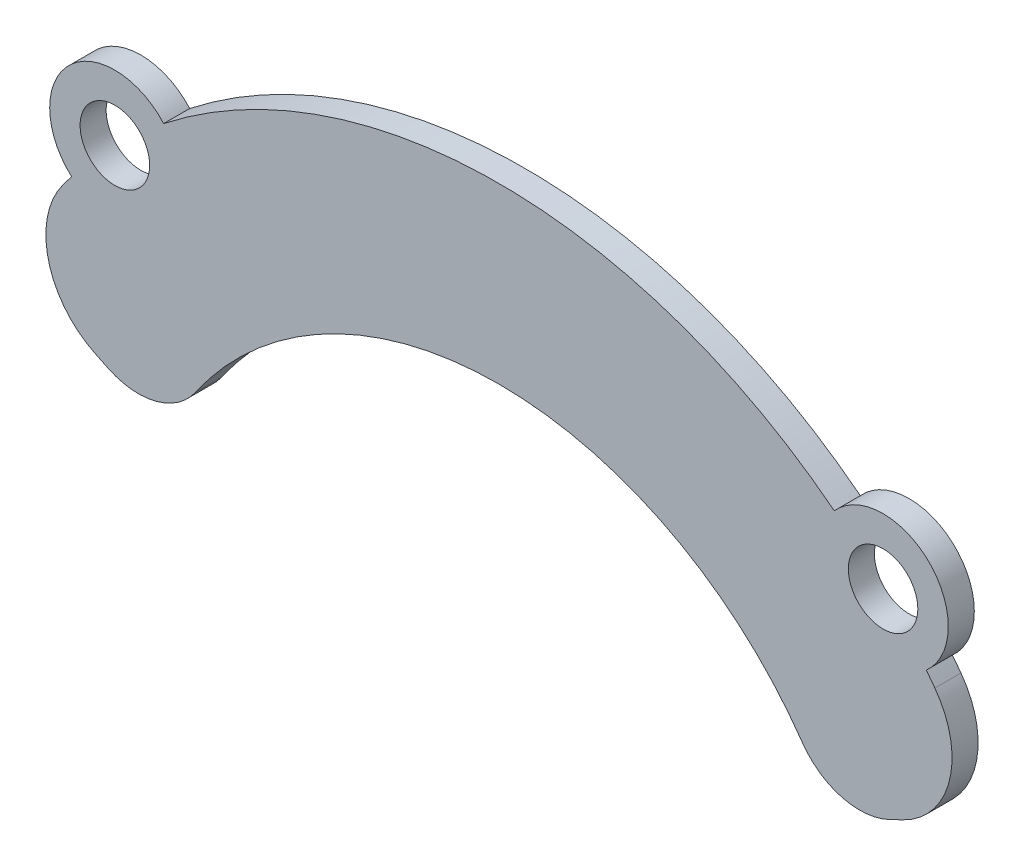
from build123d import *

# Parameters (mm, degrees)
BOSS_EXTRUDE1_DEPTH = 3
SKETCH2_R           = 4
CUT_EXTRUDE1_DEPTH  = 3
SCALE1_SCALE        = 3


with BuildPart() as part:
    # Sketch1 → Boss-Extrude1 (new body)
    with BuildSketch(Plane.XY):
        with BuildLine():
            ThreePointArc((-34.913508692, 24.234209515), (-19.70147324, 37.657694462), (0, 42.5))
            Line((0, 42.5), (0, 62.5))
            ThreePointArc((0, 62.5), (-20.410075573, 59.073503494), (-38.582229462, 49.169722083))
            ThreePointArc((-38.582229462, 49.169722083), (-44.194173824, 44.194173824), (-49.169722083, 38.582229462))
            ThreePointArc((-49.169722083, 38.582229462), (-49.667032373, 37.939898462), (-50.155952108, 37.291158043))
            ThreePointArc((-50.155952108, 37.291158043), (-51.839867242, 28.929182932), (-46.459785364, 22.31005029))
            Line((-46.459785364, 22.31005029), (-44.948491744, 21.584325098))
            ThreePointArc((-44.948491744, 21.584325098), (-39.442958133, 21.061075731), (-34.913508692, 24.234209515))
        make_face()
        with BuildLine():
            ThreePointArc((0, 42.5), (16.264045876, 39.264880132), (30.0520382, 30.0520382))
            Line((30.0520382, 30.0520382), (44.194173824, 44.194173824))
            ThreePointArc((44.194173824, 44.194173824), (41.462902158, 46.766203017), (38.582229462, 49.169722083))
            ThreePointArc((38.582229462, 49.169722083), (20.410075573, 59.073503494), (0, 62.5))
            Line((0, 62.5), (0, 42.5))
        make_face()
        with BuildLine():
            Line((44.194173824, 44.194173824), (30.0520382, 30.0520382))
            ThreePointArc((30.0520382, 30.0520382), (32.612763658, 27.251745753), (34.913508692, 24.234209515))
            ThreePointArc((34.913508692, 24.234209515), (39.442958133, 21.061075731), (44.948491744, 21.584325098))
            Line((44.948491744, 21.584325098), (46.459785364, 22.31005029))
            ThreePointArc((46.459785364, 22.31005029), (51.839867242, 28.929182932), (50.155952108, 37.291158043))
            ThreePointArc((50.155952108, 37.291158043), (49.667032373, 37.939898462), (49.169722083, 38.582229462))
            ThreePointArc((49.169722083, 38.582229462), (46.766203017, 41.462902158), (44.194173824, 44.194173824))
        make_face()
        with BuildLine():
            ThreePointArc((38.582229462, 49.169722083), (41.462902158, 46.766203017), (44.194173824, 44.194173824))
            ThreePointArc((44.194173824, 44.194173824), (46.766203017, 41.462902158), (49.169722083, 38.582229462))
            ThreePointArc((49.169722083, 38.582229462), (49.497474683, 49.497474683), (38.582229462, 49.169722083))
        make_face()
        with BuildLine():
            ThreePointArc((-49.169722083, 38.582229462), (-44.194173824, 44.194173824), (-38.582229462, 49.169722083))
            ThreePointArc((-38.582229462, 49.169722083), (-49.497474683, 49.497474683), (-49.169722083, 38.582229462))
        make_face()
    extrude(amount=BOSS_EXTRUDE1_DEPTH)

    # Sketch2 → Cut-Extrude1 (cut)
    with BuildSketch(Plane.XY.offset(3)):
        with Locations((-44.194173824, 44.194173824)):
            Circle(SKETCH2_R)
        with Locations((44.194173824, 44.194173824)):
            Circle(SKETCH2_R)
    extrude(amount=-CUT_EXTRUDE1_DEPTH, mode=Mode.SUBTRACT)


with BuildPart() as part_1:
    # Scale1: scaled about (0, 43.412850072, 1.5)
    add(part.part.scale(SCALE1_SCALE).moved(Location((0, -86.825700144, -3))))


solid = part_1.part
